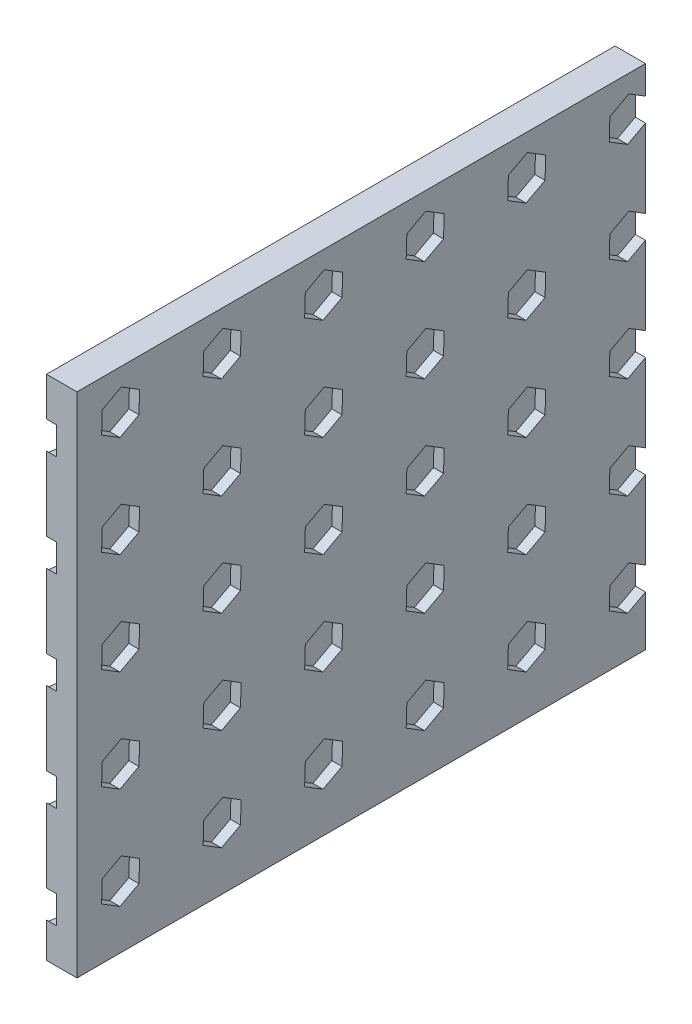
from build123d import *

# Parameters (mm, degrees)
SKETCH1_W           = 56
SKETCH1_H           = 50
BOSS_EXTRUDE1_DEPTH = 3
CUT_EXTRUDE1_DEPTH  = 1
CUT_EXTRUDE2_DEPTH  = 1


with BuildPart() as part:
    # Sketch1 → Boss-Extrude1 (new body)
    with BuildSketch(Plane(origin=(0, 0, 0), x_dir=(0, 0, -1), z_dir=(1, 0, 0))):
        Rectangle(SKETCH1_W, SKETCH1_H)
    extrude(amount=BOSS_EXTRUDE1_DEPTH)

    # Sketch2 → Cut-Extrude1 (cut)
    with BuildSketch(Plane(origin=(3, 0, 0), x_dir=(0, 0, -1), z_dir=(1, 0, 0))):
        Polygon((-11.894203014, 19.989032919), (-11.828968016, 22.112680189), (-13.635483001, 23.23099899), (-15.507232985, 22.22567052), (-15.572467983, 20.10202325), (-13.765952998, 18.983704449), align=None)
        Polygon((-21.894203014, 19.989032919), (-21.828968016, 22.112680189), (-23.635483001, 23.23099899), (-25.507232985, 22.22567052), (-25.572467983, 20.10202325), (-23.765952998, 18.983704449), align=None)
        Polygon((-1.894203014, 19.989032919), (-1.828968016, 22.112680189), (-3.635483001, 23.23099899), (-5.507232985, 22.22567052), (-5.572467983, 20.10202325), (-3.765952998, 18.983704449), align=None)
        Polygon((8.105796986, 19.989032919), (8.171031984, 22.112680189), (6.364516999, 23.23099899), (4.492767015, 22.22567052), (4.427532017, 20.10202325), (6.234047002, 18.983704449), align=None)
        Polygon((18.105796986, 19.989032919), (18.171031984, 22.112680189), (16.364516999, 23.23099899), (14.492767015, 22.22567052), (14.427532017, 20.10202325), (16.234047002, 18.983704449), align=None)
        Polygon((28.105796986, 19.989032919), (28.171031984, 22.112680189), (26.364516999, 23.23099899), (24.492767015, 22.22567052), (24.427532017, 20.10202325), (26.234047002, 18.983704449), align=None)
        Polygon((-11.894203014, 9.989032919), (-11.828968016, 12.112680189), (-13.635483001, 13.23099899), (-15.507232985, 12.22567052), (-15.572467983, 10.10202325), (-13.765952998, 8.983704449), align=None)
        Polygon((-1.894203014, 9.989032919), (-1.828968016, 12.112680189), (-3.635483001, 13.23099899), (-5.507232985, 12.22567052), (-5.572467983, 10.10202325), (-3.765952998, 8.983704449), align=None)
        Polygon((8.105796986, 9.989032919), (8.171031984, 12.112680189), (6.364516999, 13.23099899), (4.492767015, 12.22567052), (4.427532017, 10.10202325), (6.234047002, 8.983704449), align=None)
        Polygon((18.105796986, 9.989032919), (18.171031984, 12.112680189), (16.364516999, 13.23099899), (14.492767015, 12.22567052), (14.427532017, 10.10202325), (16.234047002, 8.983704449), align=None)
        Polygon((28.105796986, 9.989032919), (28.171031984, 12.112680189), (26.364516999, 13.23099899), (24.492767015, 12.22567052), (24.427532017, 10.10202325), (26.234047002, 8.983704449), align=None)
        Polygon((-11.894203014, -0.010967081), (-11.828968016, 2.112680189), (-13.635483001, 3.23099899), (-15.507232985, 2.22567052), (-15.572467983, 0.10202325), (-13.765952998, -1.016295551), align=None)
        Polygon((-1.894203014, -0.010967081), (-1.828968016, 2.112680189), (-3.635483001, 3.23099899), (-5.507232985, 2.22567052), (-5.572467983, 0.10202325), (-3.765952998, -1.016295551), align=None)
        Polygon((8.105796986, -0.010967081), (8.171031984, 2.112680189), (6.364516999, 3.23099899), (4.492767015, 2.22567052), (4.427532017, 0.10202325), (6.234047002, -1.016295551), align=None)
        Polygon((18.105796986, -0.010967081), (18.171031984, 2.112680189), (16.364516999, 3.23099899), (14.492767015, 2.22567052), (14.427532017, 0.10202325), (16.234047002, -1.016295551), align=None)
        Polygon((28.105796986, -0.010967081), (28.171031984, 2.112680189), (26.364516999, 3.23099899), (24.492767015, 2.22567052), (24.427532017, 0.10202325), (26.234047002, -1.016295551), align=None)
        Polygon((-11.894203014, -10.010967081), (-11.828968016, -7.887319811), (-13.635483001, -6.76900101), (-15.507232985, -7.77432948), (-15.572467983, -9.89797675), (-13.765952998, -11.016295551), align=None)
        Polygon((-1.894203014, -10.010967081), (-1.828968016, -7.887319811), (-3.635483001, -6.76900101), (-5.507232985, -7.77432948), (-5.572467983, -9.89797675), (-3.765952998, -11.016295551), align=None)
        Polygon((8.105796986, -10.010967081), (8.171031984, -7.887319811), (6.364516999, -6.76900101), (4.492767015, -7.77432948), (4.427532017, -9.89797675), (6.234047002, -11.016295551), align=None)
        Polygon((18.105796986, -10.010967081), (18.171031984, -7.887319811), (16.364516999, -6.76900101), (14.492767015, -7.77432948), (14.427532017, -9.89797675), (16.234047002, -11.016295551), align=None)
        Polygon((28.105796986, -10.010967081), (28.171031984, -7.887319811), (26.364516999, -6.76900101), (24.492767015, -7.77432948), (24.427532017, -9.89797675), (26.234047002, -11.016295551), align=None)
        Polygon((-11.894203014, -20.010967081), (-11.828968016, -17.887319811), (-13.635483001, -16.76900101), (-15.507232985, -17.77432948), (-15.572467983, -19.89797675), (-13.765952998, -21.016295551), align=None)
        Polygon((-1.894203014, -20.010967081), (-1.828968016, -17.887319811), (-3.635483001, -16.76900101), (-5.507232985, -17.77432948), (-5.572467983, -19.89797675), (-3.765952998, -21.016295551), align=None)
        Polygon((8.105796986, -20.010967081), (8.171031984, -17.887319811), (6.364516999, -16.76900101), (4.492767015, -17.77432948), (4.427532017, -19.89797675), (6.234047002, -21.016295551), align=None)
        Polygon((18.105796986, -20.010967081), (18.171031984, -17.887319811), (16.364516999, -16.76900101), (14.492767015, -17.77432948), (14.427532017, -19.89797675), (16.234047002, -21.016295551), align=None)
        Polygon((28.105796986, -20.010967081), (28.171031984, -17.887319811), (26.364516999, -16.76900101), (24.492767015, -17.77432948), (24.427532017, -19.89797675), (26.234047002, -21.016295551), align=None)
        Polygon((-21.894203014, 9.989032919), (-21.828968016, 12.112680189), (-23.635483001, 13.23099899), (-25.507232985, 12.22567052), (-25.572467983, 10.10202325), (-23.765952998, 8.983704449), align=None)
        Polygon((-21.894203014, -0.010967081), (-21.828968016, 2.112680189), (-23.635483001, 3.23099899), (-25.507232985, 2.22567052), (-25.572467983, 0.10202325), (-23.765952998, -1.016295551), align=None)
        Polygon((-21.894203014, -10.010967081), (-21.828968016, -7.887319811), (-23.635483001, -6.76900101), (-25.507232985, -7.77432948), (-25.572467983, -9.89797675), (-23.765952998, -11.016295551), align=None)
        Polygon((-21.894203014, -20.010967081), (-21.828968016, -17.887319811), (-23.635483001, -16.76900101), (-25.507232985, -17.77432948), (-25.572467983, -19.89797675), (-23.765952998, -21.016295551), align=None)
    extrude(amount=-CUT_EXTRUDE1_DEPTH, mode=Mode.SUBTRACT)

    # Sketch3 → Cut-Extrude2 (cut)
    with BuildSketch(Plane.ZY):
        Polygon((-12.081784525, 18.254976039), (-11.265475242, 20.21655002), (-12.556093499, 21.904281588), (-14.663021041, 21.630439175), (-15.479330325, 19.668865193), (-14.188712067, 17.981133625), align=None)
        Polygon((-22.081784525, 18.254976039), (-21.265475242, 20.21655002), (-22.556093499, 21.904281588), (-24.663021041, 21.630439175), (-25.479330325, 19.668865193), (-24.188712067, 17.981133625), align=None)
        Polygon((-2.081784525, 18.254976039), (-1.265475242, 20.21655002), (-2.556093499, 21.904281588), (-4.663021041, 21.630439175), (-5.479330325, 19.668865193), (-4.188712067, 17.981133625), align=None)
        Polygon((7.918215475, 18.254976039), (8.734524758, 20.21655002), (7.443906501, 21.904281588), (5.336978959, 21.630439175), (4.520669675, 19.668865193), (5.811287933, 17.981133625), align=None)
        Polygon((17.918215475, 18.254976039), (18.734524758, 20.21655002), (17.443906501, 21.904281588), (15.336978959, 21.630439175), (14.520669675, 19.668865193), (15.811287933, 17.981133625), align=None)
        Polygon((27.918215475, 18.254976039), (28.734524758, 20.21655002), (27.443906501, 21.904281588), (25.336978959, 21.630439175), (24.520669675, 19.668865193), (25.811287933, 17.981133625), align=None)
        Polygon((-12.081784525, 8.254976039), (-11.265475242, 10.21655002), (-12.556093499, 11.904281588), (-14.663021041, 11.630439175), (-15.479330325, 9.668865193), (-14.188712067, 7.981133625), align=None)
        Polygon((-2.081784525, 8.254976039), (-1.265475242, 10.21655002), (-2.556093499, 11.904281588), (-4.663021041, 11.630439175), (-5.479330325, 9.668865193), (-4.188712067, 7.981133625), align=None)
        Polygon((7.918215475, 8.254976039), (8.734524758, 10.21655002), (7.443906501, 11.904281588), (5.336978959, 11.630439175), (4.520669675, 9.668865193), (5.811287933, 7.981133625), align=None)
        Polygon((17.918215475, 8.254976039), (18.734524758, 10.21655002), (17.443906501, 11.904281588), (15.336978959, 11.630439175), (14.520669675, 9.668865193), (15.811287933, 7.981133625), align=None)
        Polygon((27.918215475, 8.254976039), (28.734524758, 10.21655002), (27.443906501, 11.904281588), (25.336978959, 11.630439175), (24.520669675, 9.668865193), (25.811287933, 7.981133625), align=None)
        Polygon((-12.081784525, -1.745023961), (-11.265475242, 0.21655002), (-12.556093499, 1.904281588), (-14.663021041, 1.630439175), (-15.479330325, -0.331134807), (-14.188712067, -2.018866375), align=None)
        Polygon((-2.081784525, -1.745023961), (-1.265475242, 0.21655002), (-2.556093499, 1.904281588), (-4.663021041, 1.630439175), (-5.479330325, -0.331134807), (-4.188712067, -2.018866375), align=None)
        Polygon((7.918215475, -1.745023961), (8.734524758, 0.21655002), (7.443906501, 1.904281588), (5.336978959, 1.630439175), (4.520669675, -0.331134807), (5.811287933, -2.018866375), align=None)
        Polygon((17.918215475, -1.745023961), (18.734524758, 0.21655002), (17.443906501, 1.904281588), (15.336978959, 1.630439175), (14.520669675, -0.331134807), (15.811287933, -2.018866375), align=None)
        Polygon((27.918215475, -1.745023961), (28.734524758, 0.21655002), (27.443906501, 1.904281588), (25.336978959, 1.630439175), (24.520669675, -0.331134807), (25.811287933, -2.018866375), align=None)
        Polygon((-12.081784525, -11.745023961), (-11.265475242, -9.78344998), (-12.556093499, -8.095718412), (-14.663021041, -8.369560825), (-15.479330325, -10.331134807), (-14.188712067, -12.018866375), align=None)
        Polygon((-2.081784525, -11.745023961), (-1.265475242, -9.78344998), (-2.556093499, -8.095718412), (-4.663021041, -8.369560825), (-5.479330325, -10.331134807), (-4.188712067, -12.018866375), align=None)
        Polygon((7.918215475, -11.745023961), (8.734524758, -9.78344998), (7.443906501, -8.095718412), (5.336978959, -8.369560825), (4.520669675, -10.331134807), (5.811287933, -12.018866375), align=None)
        Polygon((17.918215475, -11.745023961), (18.734524758, -9.78344998), (17.443906501, -8.095718412), (15.336978959, -8.369560825), (14.520669675, -10.331134807), (15.811287933, -12.018866375), align=None)
        Polygon((27.918215475, -11.745023961), (28.734524758, -9.78344998), (27.443906501, -8.095718412), (25.336978959, -8.369560825), (24.520669675, -10.331134807), (25.811287933, -12.018866375), align=None)
        Polygon((-12.081784525, -21.745023961), (-11.265475242, -19.78344998), (-12.556093499, -18.095718412), (-14.663021041, -18.369560825), (-15.479330325, -20.331134807), (-14.188712067, -22.018866375), align=None)
        Polygon((-2.081784525, -21.745023961), (-1.265475242, -19.78344998), (-2.556093499, -18.095718412), (-4.663021041, -18.369560825), (-5.479330325, -20.331134807), (-4.188712067, -22.018866375), align=None)
        Polygon((7.918215475, -21.745023961), (8.734524758, -19.78344998), (7.443906501, -18.095718412), (5.336978959, -18.369560825), (4.520669675, -20.331134807), (5.811287933, -22.018866375), align=None)
        Polygon((17.918215475, -21.745023961), (18.734524758, -19.78344998), (17.443906501, -18.095718412), (15.336978959, -18.369560825), (14.520669675, -20.331134807), (15.811287933, -22.018866375), align=None)
        Polygon((27.918215475, -21.745023961), (28.734524758, -19.78344998), (27.443906501, -18.095718412), (25.336978959, -18.369560825), (24.520669675, -20.331134807), (25.811287933, -22.018866375), align=None)
        Polygon((-22.081784525, 8.254976039), (-21.265475242, 10.21655002), (-22.556093499, 11.904281588), (-24.663021041, 11.630439175), (-25.479330325, 9.668865193), (-24.188712067, 7.981133625), align=None)
        Polygon((-22.081784525, -1.745023961), (-21.265475242, 0.21655002), (-22.556093499, 1.904281588), (-24.663021041, 1.630439175), (-25.479330325, -0.331134807), (-24.188712067, -2.018866375), align=None)
        Polygon((-22.081784525, -11.745023961), (-21.265475242, -9.78344998), (-22.556093499, -8.095718412), (-24.663021041, -8.369560825), (-25.479330325, -10.331134807), (-24.188712067, -12.018866375), align=None)
        Polygon((-22.081784525, -21.745023961), (-21.265475242, -19.78344998), (-22.556093499, -18.095718412), (-24.663021041, -18.369560825), (-25.479330325, -20.331134807), (-24.188712067, -22.018866375), align=None)
    extrude(amount=-CUT_EXTRUDE2_DEPTH, mode=Mode.SUBTRACT)


solid = part.part
